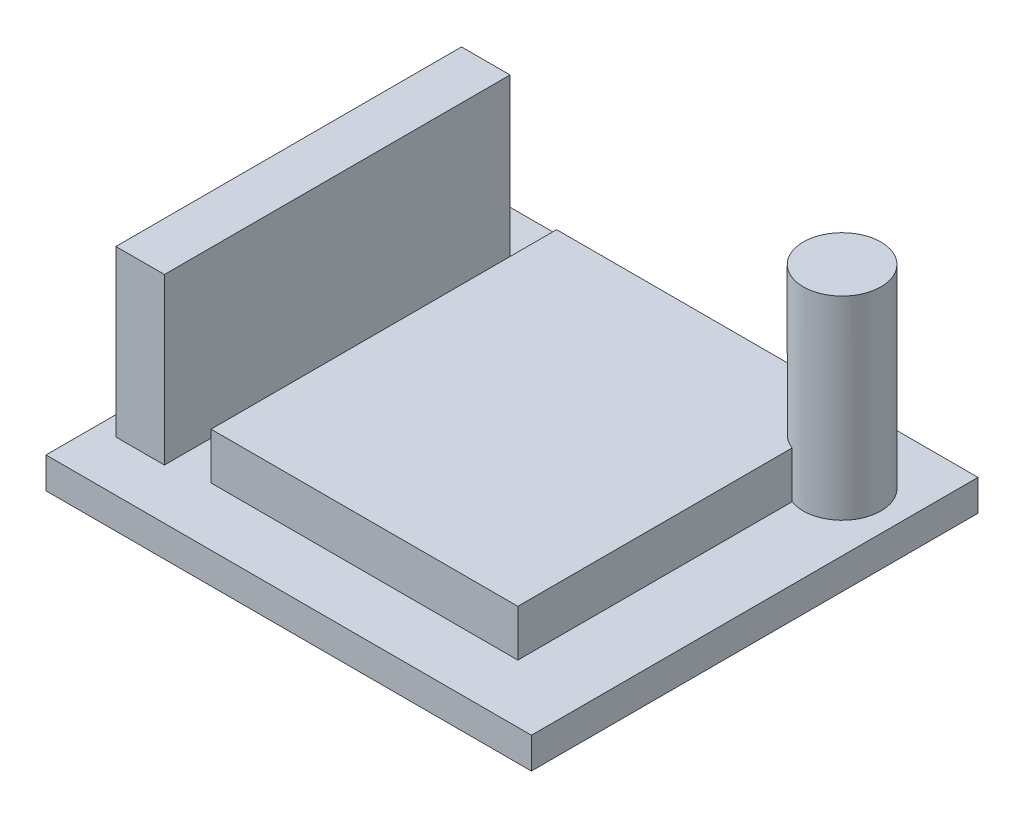
from build123d import *

# Parameters (mm, degrees)
SKETCH1_W            = 25
SKETCH1_H            = 23
PCB_DEPTH            = 1.6
SIM800L_MODULE_START = 1.6
SKETCH2_W            = 15.8
SKETCH2_H            = 17.8
SIM800L_MODULE_DEPTH = 2.4
HEADER_7PIN_START    = 1.6
SKETCH3_W            = 2.5
SKETCH3_H            = 17.8
HEADER_7PIN_DEPTH    = 8.5
ANTENNA_SPRING_START = 1.6
SKETCH4_R            = 2
ANTENNA_SPRING_DEPTH = 10
SKETCH5_W            = 19
SKETCH5_H            = 17
SIM_HOLDER_DEPTH     = 2


with BuildPart() as part:
    # Sketch1 → PCB (new body)
    with BuildSketch(Plane(origin=(0, 0, 0), x_dir=(1, 0, 0), z_dir=(0, 1, 0))):
        with Locations((12.5, 11.5)):
            Rectangle(SKETCH1_W, SKETCH1_H)
    extrude(amount=PCB_DEPTH)

    # Sketch2 → SIM800L_module (add)
    with BuildSketch(Plane(origin=(0, 0, 0), x_dir=(1, 0, 0), z_dir=(0, 1, 0)).offset(SIM800L_MODULE_START)):
        with Locations((13.4, 11.9)):
            Rectangle(SKETCH2_W, SKETCH2_H)
    extrude(amount=SIM800L_MODULE_DEPTH)

    # Sketch3 → Header_7pin (add)
    with BuildSketch(Plane(origin=(0, 0, 0), x_dir=(1, 0, 0), z_dir=(0, 1, 0)).offset(HEADER_7PIN_START)):
        with Locations((2.25, 11.5)):
            Rectangle(SKETCH3_W, SKETCH3_H)
    extrude(amount=HEADER_7PIN_DEPTH)

    # Sketch4 → Antenna_spring (add)
    with BuildSketch(Plane(origin=(0, 0, 0), x_dir=(1, 0, 0), z_dir=(0, 1, 0)).offset(ANTENNA_SPRING_START)):
        with Locations(Location((22, 19, 0), (0, 0, 115.841932763))):
            Circle(SKETCH4_R)
    extrude(amount=ANTENNA_SPRING_DEPTH)

    # Sketch5 → SIM_holder (add)
    with BuildSketch(Plane(origin=(0, 0, 0), x_dir=(1, 0, 0), z_dir=(0, 1, 0))):
        with Locations((12.5, 10.5)):
            Rectangle(SKETCH5_W, SKETCH5_H)
    extrude(amount=-SIM_HOLDER_DEPTH)


solid = part.part
